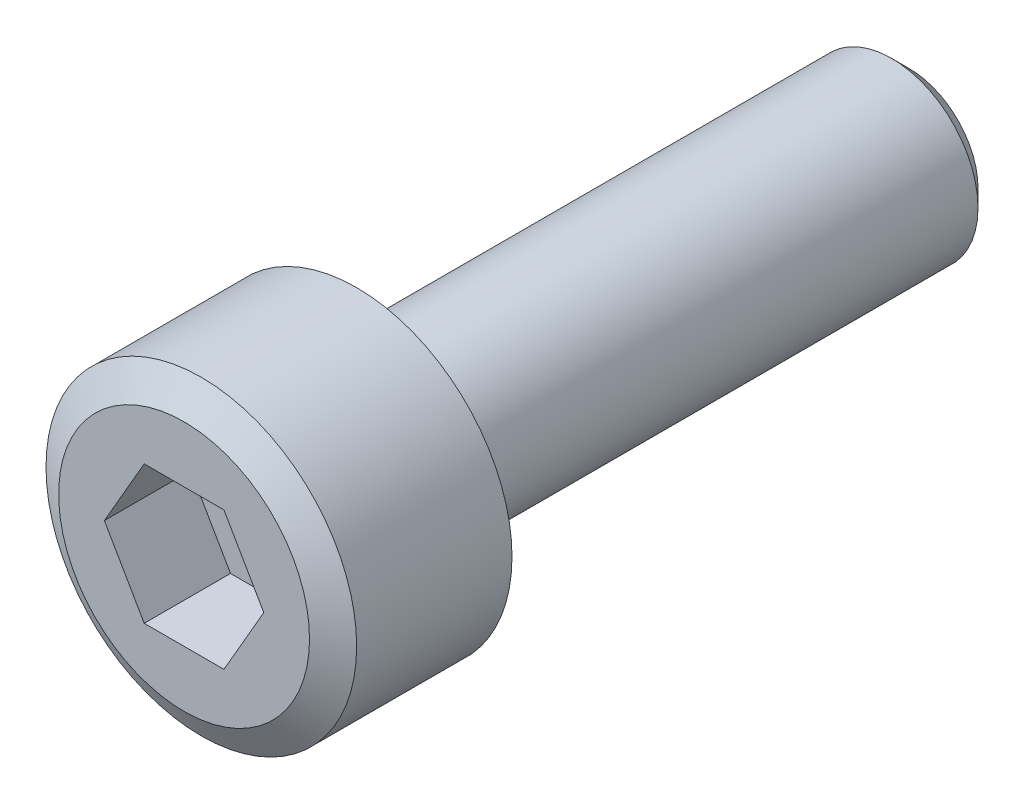
from build123d import *

# Parameters (mm, degrees)
HEX_CUT_DEPTH = 1.25


with BuildPart() as part:
    # Body_Sketch → Body_Revolve (revolve)
    with BuildSketch(Plane(origin=(0, 0, 0), x_dir=(0, 0, -1), z_dir=(1, 0, 0))):
        with BuildLine():
            Line((8, 0), (8, 1))
            Line((8, 1), (7.75, 1.25))
            Line((7.75, 1.25), (0.1, 1.25))
            ThreePointArc((0.1, 1.25), (0.029289322, 1.279289322), (0, 1.35))
            Line((0, 1.35), (0, 2.25))
            Line((0, 2.25), (-2.25, 2.25))
            Line((-2.25, 2.25), (-2.5, 1.816987298))
            Line((-2.5, 1.816987298), (-2.5, 0))
            Line((-2.5, 0), (8, 0))
        make_face()
    revolve(axis=Axis((0, 0, 0), (0, 0, -1)))

    # Key_Sketch → Hex_Cut (cut)
    with BuildSketch(Plane.XY.offset(2.5)):
        Polygon((1.154700538, 0), (0.577350269, 1), (-0.577350269, 1), (-1.154700538, 0), (-0.577350269, -1), (0.577350269, -1), align=None)
    extrude(amount=-HEX_CUT_DEPTH, mode=Mode.SUBTRACT)


solid = part.part
